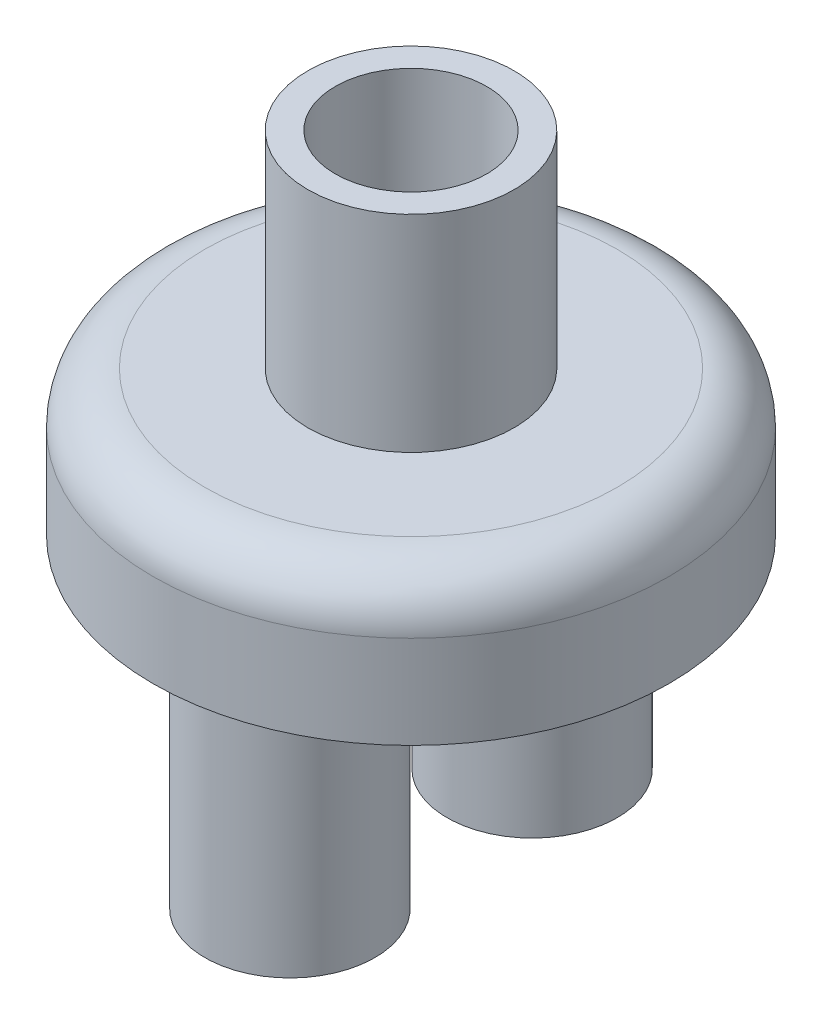
from build123d import *

# Parameters (mm, degrees)
SKETCH1_R           = 10
BOSS_EXTRUDE1_DEPTH = 20
SKETCH2_R           = 25
BOSS_EXTRUDE2_DEPTH = 22
SKETCH3_R           = 20.5
CUT_EXTRUDE1_DEPTH  = 20
FILLET1_R           = 5
SKETCH4_R           = 7.35
CUT_EXTRUDE2_DEPTH  = 20
SKETCH5_R           = 8.25
BOSS_EXTRUDE3_DEPTH = 37.5
SKETCH6_R           = 4.5
CUT_EXTRUDE3_DEPTH  = 30
SKETCH7_R           = 25
SKETCH7_R_2         = 20.5
CUT_EXTRUDE4_DEPTH  = 8


with BuildPart() as part:
    # Sketch1 → Boss-Extrude1 (new body)
    with BuildSketch(Plane(origin=(0, 0, 0), x_dir=(1, 0, 0), z_dir=(0, 1, 0))):
        with Locations(Location((0, 0, 0), (0, 0, 270))):
            Circle(SKETCH1_R)
    extrude(amount=BOSS_EXTRUDE1_DEPTH)

    # Sketch2 → Boss-Extrude2 (add)
    with BuildSketch(Plane.XZ):
        with Locations(Location((0, 0, 0), (0, 0, 270))):
            Circle(SKETCH2_R)
    extrude(amount=BOSS_EXTRUDE2_DEPTH)

    # Sketch3 → Cut-Extrude1 (cut)
    with BuildSketch(Plane.XZ.offset(22)):
        with Locations(Location((0, 0, 0), (0, 0, 270))):
            Circle(SKETCH3_R)
    extrude(amount=-CUT_EXTRUDE1_DEPTH, mode=Mode.SUBTRACT)

    # Fillet1
    fillet1_edges = [part.edges().sort_by_distance(p)[0] for p in [
        (0, 0, 25),
    ]]
    fillet(fillet1_edges, radius=FILLET1_R)

    # Sketch4 → Cut-Extrude2 (cut)
    with BuildSketch(Plane(origin=(0, 20, 0), x_dir=(1, 0, 0), z_dir=(0, 1, 0))):
        with Locations(Location((0, 0, 0), (0, 0, 270))):
            Circle(SKETCH4_R)
    extrude(amount=-CUT_EXTRUDE2_DEPTH, mode=Mode.SUBTRACT)

    # Sketch5 → Boss-Extrude3 (add)
    with BuildSketch(Plane.XZ.offset(2)):
        with Locations(Location((0, 11.748259103, 0), (0, 0, 270))):
            Circle(SKETCH5_R)
        with Locations(Location((0, -11.748259103, 0), (0, 0, 270))):
            Circle(SKETCH5_R)
    extrude(amount=BOSS_EXTRUDE3_DEPTH)

    # Sketch6 → Cut-Extrude3 (cut)
    with BuildSketch(Plane.XZ.offset(39.5)):
        with Locations(Location((0, 11.748259103, 0), (0, 0, 270))):
            Circle(SKETCH6_R)
        with Locations(Location((0, -11.748259103, 0), (0, 0, 270))):
            Circle(SKETCH6_R)
    extrude(amount=-CUT_EXTRUDE3_DEPTH, mode=Mode.SUBTRACT)

    # Sketch7 → Cut-Extrude4 (cut)
    with BuildSketch(Plane.XZ.offset(22)):
        with Locations(Location((0, 0, 0), (0, 0, 270))):
            Circle(SKETCH7_R)
        with Locations(Location((0, 0, 0), (0, 0, 270))):
            Circle(SKETCH7_R_2, mode=Mode.SUBTRACT)
    extrude(amount=-CUT_EXTRUDE4_DEPTH, mode=Mode.SUBTRACT)


solid = part.part
